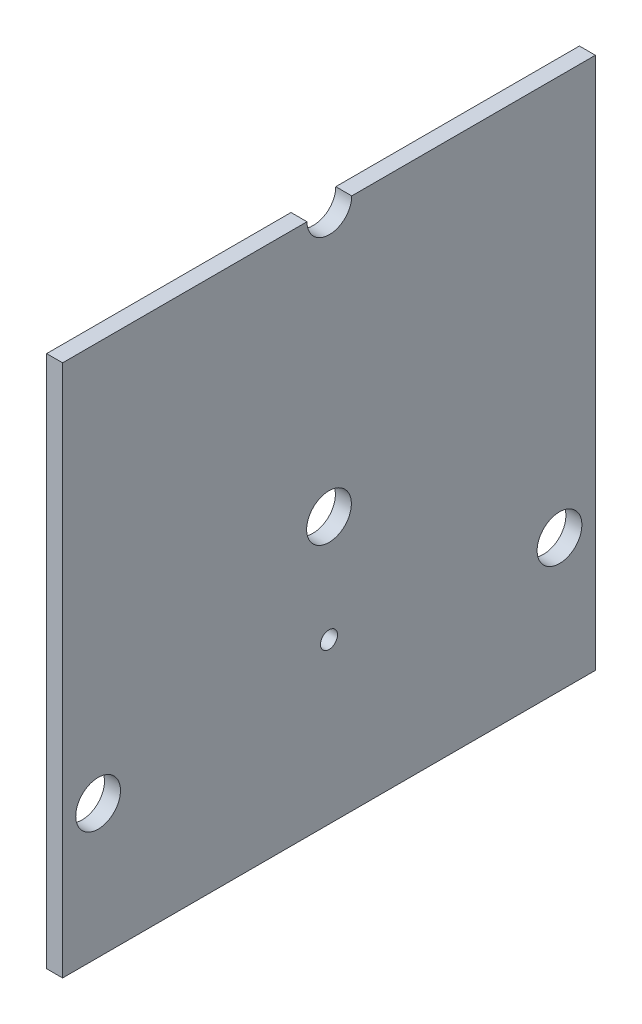
from build123d import *

# Parameters (mm, degrees)
SKETCH2_W           = 100
SKETCH2_H           = 100
SKETCH2_R           = 4.2
BOSS_EXTRUDE1_DEPTH = 3
SKETCH3_R           = 4.2
CUT_EXTRUDE1_DEPTH  = 10
SKETCH4_R           = 1.6
CUT_EXTRUDE2_DEPTH  = 10


with BuildPart() as part:
    # Sketch2 → Boss-Extrude1 (new body)
    with BuildSketch(Plane(origin=(0, 0, 0), x_dir=(0, 0, -1), z_dir=(1, 0, 0))):
        Rectangle(SKETCH2_W, SKETCH2_H)
        Circle(SKETCH2_R, mode=Mode.SUBTRACT)
    extrude(amount=BOSS_EXTRUDE1_DEPTH)

    # Sketch3 → Cut-Extrude1 (cut)
    with BuildSketch(Plane.ZY):
        with Locations((43.336976945, -24.938051834)):
            Circle(SKETCH3_R)
        with Locations((-43.265474881, -25.061897041)):
            Circle(SKETCH3_R)
        with Locations((-0.071502064, 49.999948875)):
            Circle(SKETCH3_R)
    extrude(amount=-CUT_EXTRUDE1_DEPTH, mode=Mode.SUBTRACT)

    # Sketch4 → Cut-Extrude2 (cut)
    with BuildSketch(Plane.ZY):
        with Locations((0, -20)):
            Circle(SKETCH4_R)
    extrude(amount=-CUT_EXTRUDE2_DEPTH, mode=Mode.SUBTRACT)


solid = part.part
